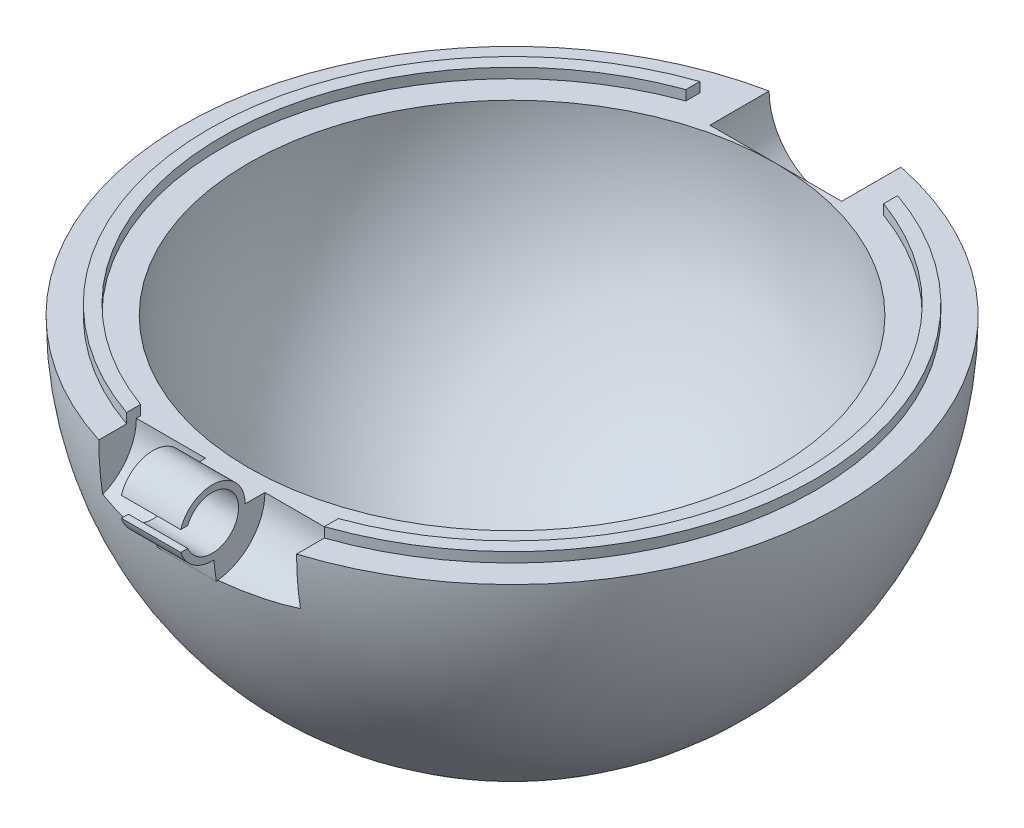
from build123d import *

# Parameters (mm, degrees)
CUT_EXTRUDE1_DEPTH       = 15
CUT_EXTRUDE1_DEPTH_BACK  = 15
SKETCH2_R                = 8
BOSS_EXTRUDE1_DEPTH      = 4.5
BOSS_EXTRUDE1_DEPTH_BACK = 4.5
SKETCH3_R                = 5
SKETCH3_R_2              = 4
BOSS_EXTRUDE2_DEPTH      = 4.5
BOSS_EXTRUDE2_DEPTH_BACK = 4.5
SKETCH5_R                = 10
CUT_EXTRUDE2_DEPTH       = 10
BOSS_EXTRUDE3_DEPTH      = 1.5
BOSS_EXTRUDE6_DEPTH      = 4.5
BOSS_EXTRUDE6_DEPTH_BACK = 4.5
CUT_EXTRUDE3_DEPTH       = 4.5
CUT_EXTRUDE3_DEPTH_BACK  = 4.5
SKETCH11_W               = 10
SKETCH11_H               = 3
SKETCH12_R               = 10
CUT_EXTRUDE4_DEPTH       = 1


with BuildPart() as part:
    # Sketch1 → Revolve1 (revolve)
    with BuildSketch(Plane(origin=(0, 0, 0), x_dir=(0, 0, -1), z_dir=(1, 0, 0))):
        with BuildLine():
            Line((0, -40), (0, -50))
            ThreePointArc((0, -50), (35.355339059, -35.355339059), (50, 0))
            Line((50, 0), (40, 0))
            ThreePointArc((40, 0), (28.284271247, -28.284271247), (0, -40))
        make_face()
    revolve(axis=Axis((0, 58.068573396, 0), (0, -1, 0)))

    # Sketch2 → Cut-Extrude1 (cut, two sides: drawn at the far end of the back side and taken through both)
    with BuildSketch(Plane(origin=(0, 0, 0), x_dir=(0, 0, -1), z_dir=(1, 0, 0)).offset(-CUT_EXTRUDE1_DEPTH_BACK)):
        with Locations((-50, 0)):
            Circle(SKETCH2_R)
    extrude(amount=CUT_EXTRUDE1_DEPTH + CUT_EXTRUDE1_DEPTH_BACK, mode=Mode.SUBTRACT)



with BuildPart() as body_2:
    # Sketch3 → Boss-Extrude1 (new, two sides: drawn at the far end of the back side and taken through both)
    with BuildSketch(Plane(origin=(0, 0, 0), x_dir=(0, 0, -1), z_dir=(1, 0, 0)).offset(-BOSS_EXTRUDE1_DEPTH_BACK)):
        with Locations((-50, 0)):
            Circle(SKETCH3_R)
        with Locations((-50, 0)):
            Circle(SKETCH3_R_2, mode=Mode.SUBTRACT)
    extrude(amount=BOSS_EXTRUDE1_DEPTH + BOSS_EXTRUDE1_DEPTH_BACK)


with BuildPart() as part_1:
    add(part.part)

    add(body_2.part)  # Boss-Extrude2 merges body 2
    # Sketch4 → Boss-Extrude2 (add, two sides: drawn at the far end of the back side and taken through both)
    with BuildSketch(Plane(origin=(0, 0, 0), x_dir=(0, 0, -1), z_dir=(1, 0, 0)).offset(-BOSS_EXTRUDE2_DEPTH_BACK)):
        with BuildLine():
            Line((-46, 0), (-40, 0))
            Line((-40, 0), (-40, -5))
            Line((-40, -5), (-50, -5))
            Line((-50, -5), (-50, -4))
            ThreePointArc((-50, -4), (-47.171572875, -2.828427125), (-46, 0))
        make_face()
    extrude(amount=BOSS_EXTRUDE2_DEPTH + BOSS_EXTRUDE2_DEPTH_BACK)

    # Sketch5 → Cut-Extrude2 (cut)
    with BuildSketch(Plane.XY.offset(-50)):
        Circle(SKETCH5_R)
    extrude(amount=CUT_EXTRUDE2_DEPTH, mode=Mode.SUBTRACT)

    # Sketch6 → Boss-Extrude3 (add)
    with BuildSketch(Plane(origin=(0, 0, 0), x_dir=(1, 0, 0), z_dir=(0, 1, 0))):
        with BuildLine():
            Line((-15, 43.48562981), (-15, 41.36423576))
            ThreePointArc((-15, 41.36423576), (-44, 0), (-15, -41.36423576))
            Line((-15, -41.36423576), (-15, -43.48562981))
            ThreePointArc((-15, -43.48562981), (-46, 0), (-15, 43.48562981))
        make_face()
        with BuildLine():
            Line((15, 43.48562981), (15, 41.36423576))
            ThreePointArc((15, 41.36423576), (44, 0), (15, -41.36423576))
            Line((15, -41.36423576), (15, -43.48562981))
            ThreePointArc((15, -43.48562981), (46, 0), (15, 43.48562981))
        make_face()
    extrude(amount=BOSS_EXTRUDE3_DEPTH)

    # Sketch10 → Boss-Extrude6 (add, two sides: drawn at the far end of the back side and taken through both)
    with BuildSketch(Plane(origin=(0, 0, 0), x_dir=(0, 0, -1), z_dir=(1, 0, 0)).offset(-BOSS_EXTRUDE6_DEPTH_BACK)):
        with BuildLine():
            Line((-49.749371855, -5), (-40, -5))
            Line((-40, -5), (-40, -8))
            Line((-40, -8), (-49.355850717, -8))
            ThreePointArc((-49.355850717, -8), (-49.57530923, -6.502977374), (-49.749371855, -5))
        make_face()
    extrude(amount=BOSS_EXTRUDE6_DEPTH + BOSS_EXTRUDE6_DEPTH_BACK)

    # Sketch11 → Cut-Extrude3 (cut, two sides: drawn at the far end of the back side and taken through both)
    with BuildSketch(Plane(origin=(0, 0, 0), x_dir=(0, 0, -1), z_dir=(1, 0, 0)).offset(-CUT_EXTRUDE3_DEPTH_BACK)):
        with Locations((-55, 0)):
            Rectangle(SKETCH11_W, SKETCH11_H)
    extrude(amount=CUT_EXTRUDE3_DEPTH + CUT_EXTRUDE3_DEPTH_BACK, mode=Mode.SUBTRACT)

    # Sketch12 → Cut-Extrude4 (cut)
    with BuildSketch(Plane(origin=(0, -50, 0), x_dir=(1, 0, 0), z_dir=(0, 1, 0))):
        Circle(SKETCH12_R)
    extrude(amount=CUT_EXTRUDE4_DEPTH, mode=Mode.SUBTRACT)


solid = part_1.part
